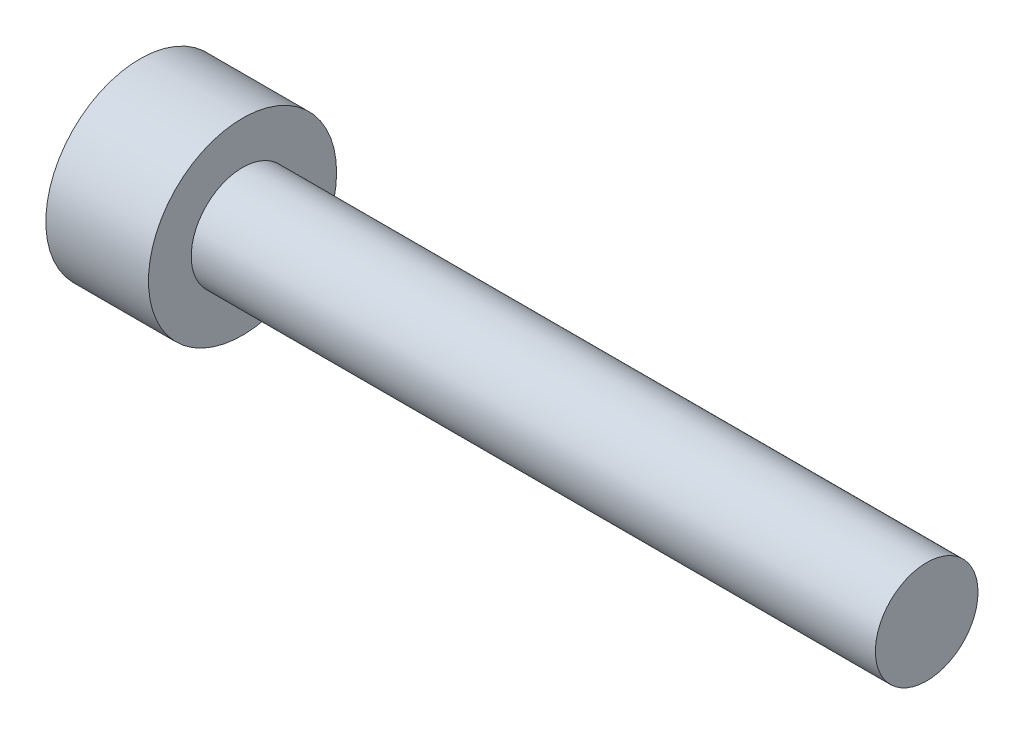
from build123d import *

# Parameters (mm, degrees)
SKIZZE1_R                       = 2.75
AUFSATZ_LINEAR_AUSTRAGEN1_DEPTH = 3
AUFSATZ_LINEAR_START            = 3
SKIZZE2_R                       = 1.5
AUFSATZ_LINEAR_AUSTRAGEN2_DEPTH = 20


with BuildPart() as part:
    # Skizze1 → Aufsatz-Linear austragen1 (new body)
    with BuildSketch(Plane.YZ):
        with Locations(Location((0, 0, 0), (0, 0, 270))):
            Circle(SKIZZE1_R)
    extrude(amount=AUFSATZ_LINEAR_AUSTRAGEN1_DEPTH)

    # Skizze2 → Aufsatz-Linear austragen2 (add)
    with BuildSketch(Plane.YZ.offset(AUFSATZ_LINEAR_START)):
        with Locations(Location((0, 0, 0), (0, 0, 270))):
            Circle(SKIZZE2_R)
    extrude(amount=AUFSATZ_LINEAR_AUSTRAGEN2_DEPTH)


solid = part.part
